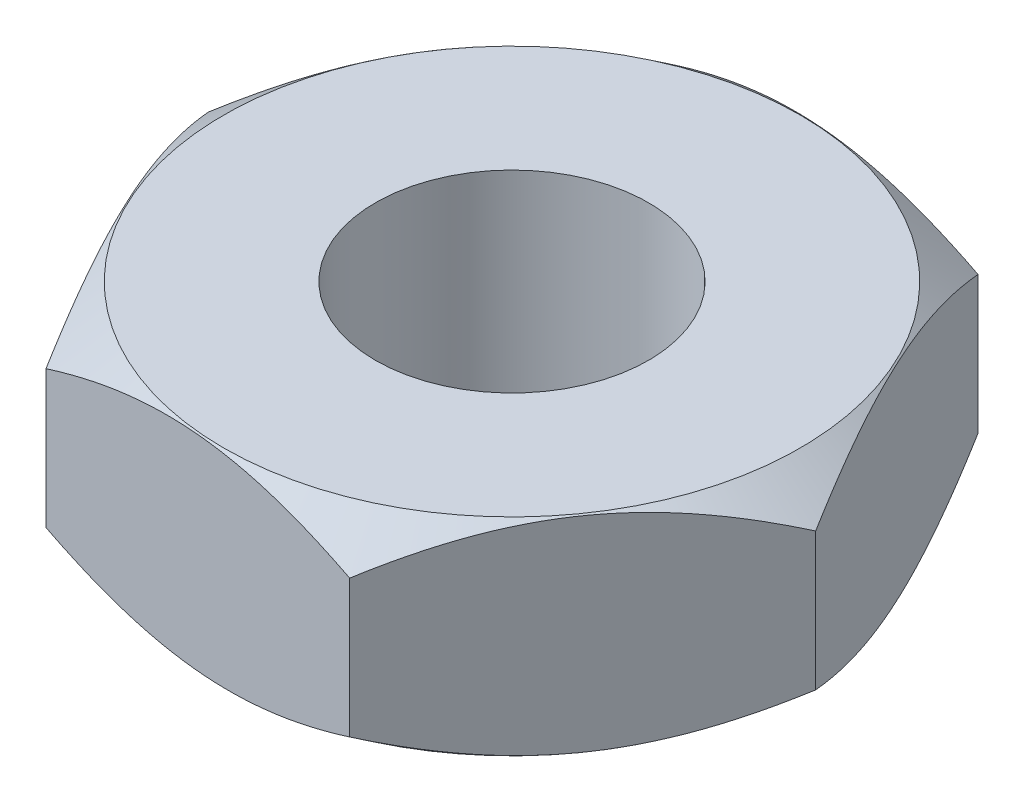
from build123d import *

# Parameters (mm, degrees)
SKETCH1_R           = 3.3
BOSS_EXTRUDE1_DEPTH = 2.5


with BuildPart() as part:
    # Sketch1 → Boss-Extrude1 (new, symmetric)
    with BuildSketch(Plane(origin=(0, 0, 0), x_dir=(1, 0, 0), z_dir=(0, 1, 0))):
        Polygon((8.051309858, -0.713962815), (4.643964864, 6.615657463), (-3.407344994, 7.329620279), (-8.051309858, 0.713962815), (-4.643964864, -6.615657463), (3.407344994, -7.329620279), align=None)
        with Locations(Location((0, 0, 0), (0, 0, 270))):
            Circle(SKETCH1_R, mode=Mode.SUBTRACT)
    extrude(amount=BOSS_EXTRUDE1_DEPTH, both=True)

    # Sketch2 → Cut-Revolve1 (revolve, cut)
    with BuildSketch(Plane.XY, mode=Mode.PRIVATE) as cut_revolve1_sk:
        Polygon((6.3, 3), (8.3, 3), (8.3, 1.5), align=None)
    cut_revolve1 = revolve(cut_revolve1_sk.sketch.rotate(Axis((0, 3.572353643, 0), (0, -1, 0)), 245.067539953), axis=Axis((0, 3.572353643, 0), (0, -1, 0)), mode=Mode.SUBTRACT)

    # Mirror1: Cut-Revolve1 across plane
    add(cut_revolve1.mirror(Plane.ZX), mode=Mode.SUBTRACT)


solid = part.part
